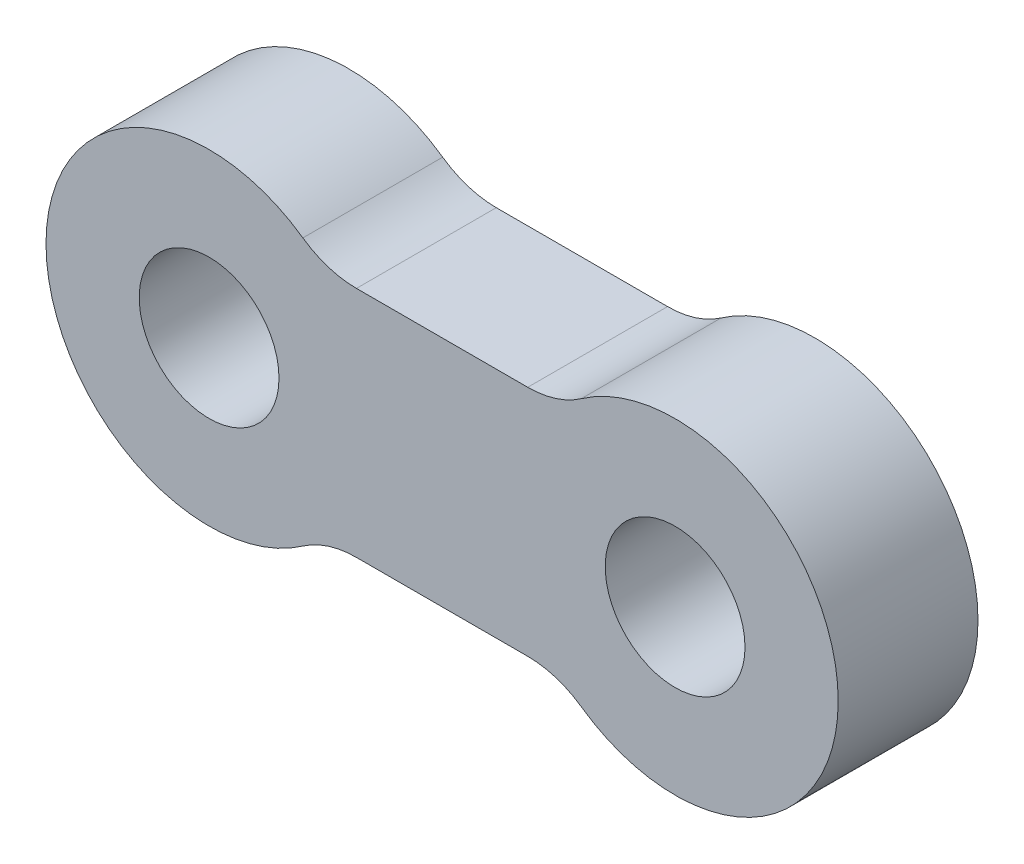
from build123d import *

# Parameters (mm, degrees)
SKETCH_1_R      = 1.5
EXTRUDE_1_DEPTH = 3


with BuildPart() as part:
    # 草图1 → 凸台-拉伸1 (new body)
    with BuildSketch(Plane.XY):
        with BuildLine():
            Line((3.16227766, 2.5), (6.83772234, 2.5))
            ThreePointArc((6.83772234, 2.5), (7.440745029, 2.593074822), (7.987641489, 2.863636364))
            ThreePointArc((7.987641489, 2.863636364), (13.5, 0), (7.987641489, -2.863636364))
            ThreePointArc((7.987641489, -2.863636364), (7.440745029, -2.593074822), (6.83772234, -2.5))
            Line((6.83772234, -2.5), (3.16227766, -2.5))
            ThreePointArc((3.16227766, -2.5), (2.559254971, -2.593074822), (2.012358511, -2.863636364))
            ThreePointArc((2.012358511, -2.863636364), (-3.5, 0), (2.012358511, 2.863636364))
            ThreePointArc((2.012358511, 2.863636364), (2.559254971, 2.593074822), (3.16227766, 2.5))
        make_face()
        Circle(SKETCH_1_R, mode=Mode.SUBTRACT)
        with Locations((10, 0)):
            Circle(SKETCH_1_R, mode=Mode.SUBTRACT)
    extrude(amount=EXTRUDE_1_DEPTH)


solid = part.part
